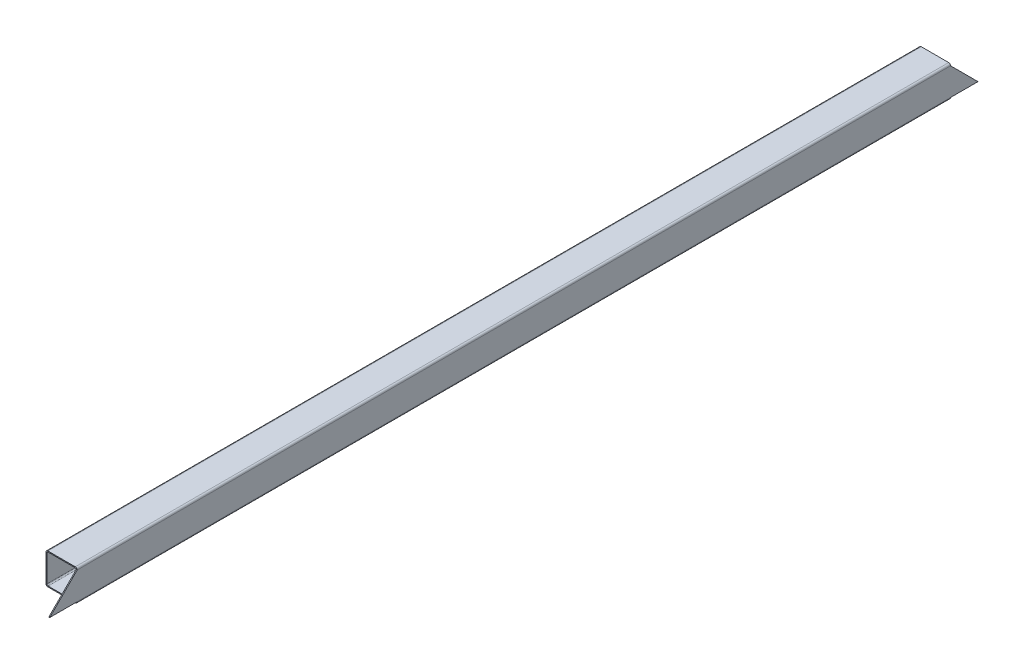
from build123d import *

# Parameters (mm, degrees)
EXTRUDE_1_DEPTH = 2800
EXTRUDE_2_DEPTH = 3


with BuildPart() as part:
    # Эскиз1 → Бобышка-Вытянуть1 (new body)
    with BuildSketch(Plane.XY):
        with BuildLine():
            Line((-44, 50), (44, 50))
            ThreePointArc((44, 50), (48.242640687, 48.242640687), (50, 44))
            Line((50, 44), (50, -44))
            ThreePointArc((50, -44), (48.242640687, -48.242640687), (44, -50))
            Line((44, -50), (-44, -50))
            ThreePointArc((-44, -50), (-48.242640687, -48.242640687), (-50, -44))
            Line((-50, -44), (-50, 44))
            ThreePointArc((-50, 44), (-48.242640687, 48.242640687), (-44, 50))
        make_face()
        with BuildLine():
            Line((-43, 47), (43, 47))
            ThreePointArc((43, 47), (45.828427125, 45.828427125), (47, 43))
            Line((47, 43), (47, -43))
            ThreePointArc((47, -43), (45.828427125, -45.828427125), (43, -47))
            Line((43, -47), (-43, -47))
            ThreePointArc((-43, -47), (-45.828427125, -45.828427125), (-47, -43))
            Line((-47, -43), (-47, 43))
            ThreePointArc((-47, 43), (-45.828427125, 45.828427125), (-43, 47))
        make_face(mode=Mode.SUBTRACT)
    extrude(amount=-EXTRUDE_1_DEPTH)

    # Эскиз2 → Бобышка-Вытянуть2 (add)
    with BuildSketch(Plane(origin=(50, 0, 0), x_dir=(0, 0, -1), z_dir=(1, 0, 0))):
        Polygon((0, -44), (0, 44), (-88, -44), align=None)
        Polygon((2800, -44), (2800, 44), (2888, -44), align=None)
    extrude(amount=-EXTRUDE_2_DEPTH)


solid = part.part
